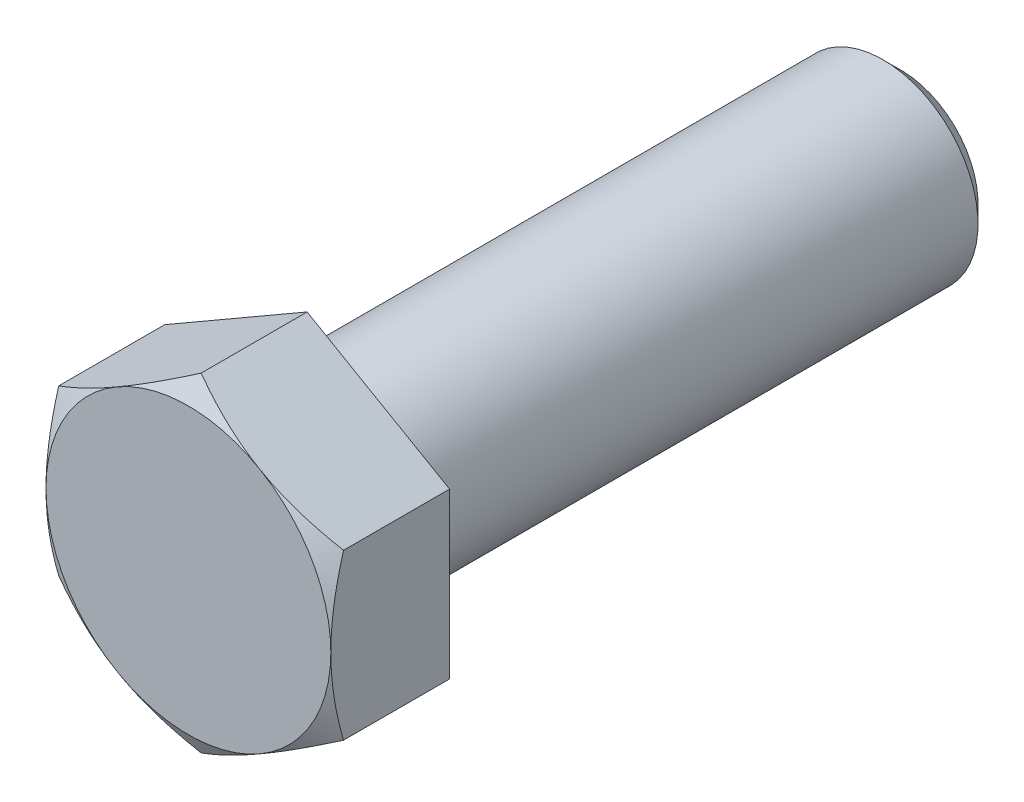
from build123d import *

# Parameters (mm, degrees)
EXTRUDE_376_DEPTH   = 10
SKETCH_2_OUTSIDE_W  = 172.148
SKETCH_2_OUTSIDE_H  = 175.86
SKETCH_2_OUTSIDE_R  = 11.994451842
CUT_EXTRUDE_1_DEPTH = 40
CUT_EXTRUDE_1_DRAFT = -60
SKETCH_3_R          = 8
EXTRUDE_1_DEPTH     = 50
CHAMFER_1_SIZE      = 1.5
FILLET_1_R          = 1


with BuildPart() as part:
    # Эскиз1 → Extrude 376 (new body)
    with BuildSketch(Plane.XY):
        Polygon((-11.994451842, 6.925), (0, 13.85), (11.994451842, 6.925), (11.994451842, -6.925), (0, -13.85), (-11.994451842, -6.925), align=None)
    extrude(amount=EXTRUDE_376_DEPTH)


with BuildPart() as cut_extrude_1_tool:
    # Эскиз2 outside → Вырез-Вытянуть1 (with draft: the straight prism first)
    with BuildSketch(Plane.XY.offset(10)):
        Rectangle(SKETCH_2_OUTSIDE_W, SKETCH_2_OUTSIDE_H)
        Circle(SKETCH_2_OUTSIDE_R, mode=Mode.SUBTRACT)
    extrude(amount=-CUT_EXTRUDE_1_DEPTH)
    # Вырез-Вытянуть1: the draft: its side faces are tilted about the plane it starts from
    cut_extrude_1_sides = [cut_extrude_1_tool.faces().sort_by_distance(p)[0] for p in [
        (0, -87.93, -10),
        (86.074, 0, -10),
        (0, 87.93, -10),
        (-86.074, 0, -10),
        (-11.994451842, 0, -10),
    ]]
    draft(cut_extrude_1_sides, Plane.XY.offset(10), CUT_EXTRUDE_1_DRAFT)


with BuildPart() as part_1:
    add(part.part)

    # Вырез-Вытянуть1: cut by cut_extrude_1_tool
    add(cut_extrude_1_tool.part, mode=Mode.SUBTRACT)

    # Эскиз3 → Бобышка-Вытянуть1 (add)
    with BuildSketch(Plane(origin=(0, 0, 0), x_dir=(-1, 0, 0), z_dir=(0, 0, -1))):
        Circle(SKETCH_3_R)
    extrude(amount=EXTRUDE_1_DEPTH)

    # Фаска1
    chamfer_1_edges = [part_1.edges().sort_by_distance(p)[0] for p in [
        (8, 0, -50),
    ]]
    chamfer(chamfer_1_edges, length=CHAMFER_1_SIZE)

    # Скругление1
    fillet_1_edges = [part_1.edges().sort_by_distance(p)[0] for p in [
        (8, 0, 0),
    ]]
    fillet(fillet_1_edges, radius=FILLET_1_R)


solid = part_1.part
